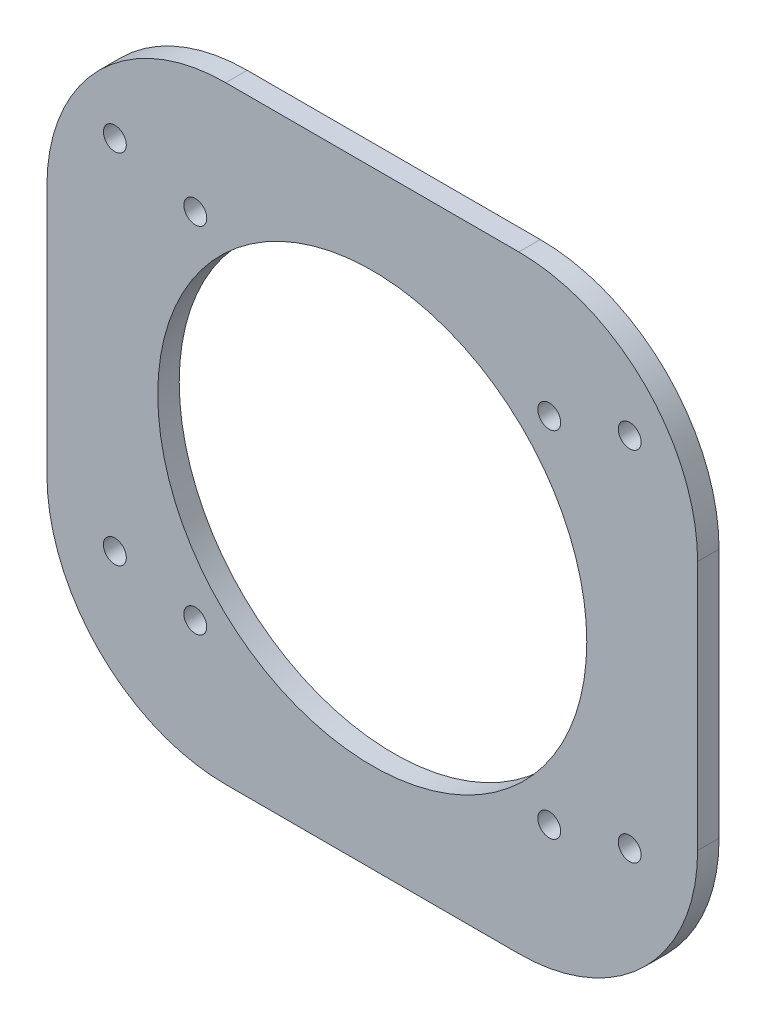
from build123d import *

# Parameters (mm, degrees)
SKETCH_1_W          = 91
SKETCH_1_H          = 74
SKETCH_1_R          = 1.6
EXTRUDE_1_DEPTH     = 3
SKETCH_2_R          = 30
SKETCH_2_R_2        = 1.6
CUT_EXTRUDE_1_DEPTH = 10
SKETCH_3_W          = 91
SKETCH_3_H          = 6
CUT_EXTRUDE_2_DEPTH = 10
SKETCH_4_W          = 91
SKETCH_4_H          = 8.5
SKETCH_4_H_2        = 14.5
EXTRUDE_2_DEPTH     = 3
SKETCH_5_W          = 91
SKETCH_5_H          = 6
CUT_EXTRUDE_3_DEPTH = 3
FILLET_4_R          = 25


with BuildPart() as part:
    # 草图1 → 凸台-拉伸1 (new body)
    with BuildSketch(Plane.XY):
        Rectangle(SKETCH_1_W, SKETCH_1_H)
        with Locations((36, -25)):
            Circle(SKETCH_1_R, mode=Mode.SUBTRACT)
        with Locations((36, 25)):
            Circle(SKETCH_1_R, mode=Mode.SUBTRACT)
        with Locations(Location((-36, 25, 0), (0, 0, 180))):
            Circle(SKETCH_1_R, mode=Mode.SUBTRACT)
        with Locations(Location((-36, -25, 0), (0, 0, 180))):
            Circle(SKETCH_1_R, mode=Mode.SUBTRACT)
    extrude(amount=EXTRUDE_1_DEPTH)

    # 草图2 → 切除-拉伸1 (cut)
    with BuildSketch(Plane.XY.offset(3)):
        with Locations((0, -3)):
            Circle(SKETCH_2_R)
        with Locations((24.748737342, -27.748737342)):
            Circle(SKETCH_2_R_2)
        with Locations((24.748737342, 21.748737342)):
            Circle(SKETCH_2_R_2)
        with Locations((-24.748737342, -27.748737342)):
            Circle(SKETCH_2_R_2)
        with Locations((-24.748737342, 21.748737342)):
            Circle(SKETCH_2_R_2)
    extrude(amount=-CUT_EXTRUDE_1_DEPTH, mode=Mode.SUBTRACT)

    # 草图3 → 切除-拉伸2 (cut)
    with BuildSketch(Plane.XY.offset(3)):
        with Locations((0, 34)):
            Rectangle(SKETCH_3_W, SKETCH_3_H)
    extrude(amount=-CUT_EXTRUDE_2_DEPTH, mode=Mode.SUBTRACT)

    # 草图4 → 凸台-拉伸2 (add)
    with BuildSketch(Plane.XY.offset(3)):
        with Locations((0, -41.25)):
            Rectangle(SKETCH_4_W, SKETCH_4_H)
        with Locations((0, 38.25)):
            Rectangle(SKETCH_4_W, SKETCH_4_H_2)
    extrude(amount=-EXTRUDE_2_DEPTH)

    # 草图5 → 切除-拉伸3 (cut)
    with BuildSketch(Plane.XY.offset(3)):
        with Locations((0, 42.5)):
            Rectangle(SKETCH_5_W, SKETCH_5_H)
    extrude(amount=-CUT_EXTRUDE_3_DEPTH, mode=Mode.SUBTRACT)

    # 圆角4
    fillet_4_edges = [part.edges().sort_by_distance(p)[0] for p in [
        (-45.5, 39.5, 1.5),
        (45.5, 39.5, 1.5),
        (-45.5, -45.5, 1.5),
        (45.5, -45.5, 1.5),
    ]]
    fillet(fillet_4_edges, radius=FILLET_4_R)


solid = part.part
